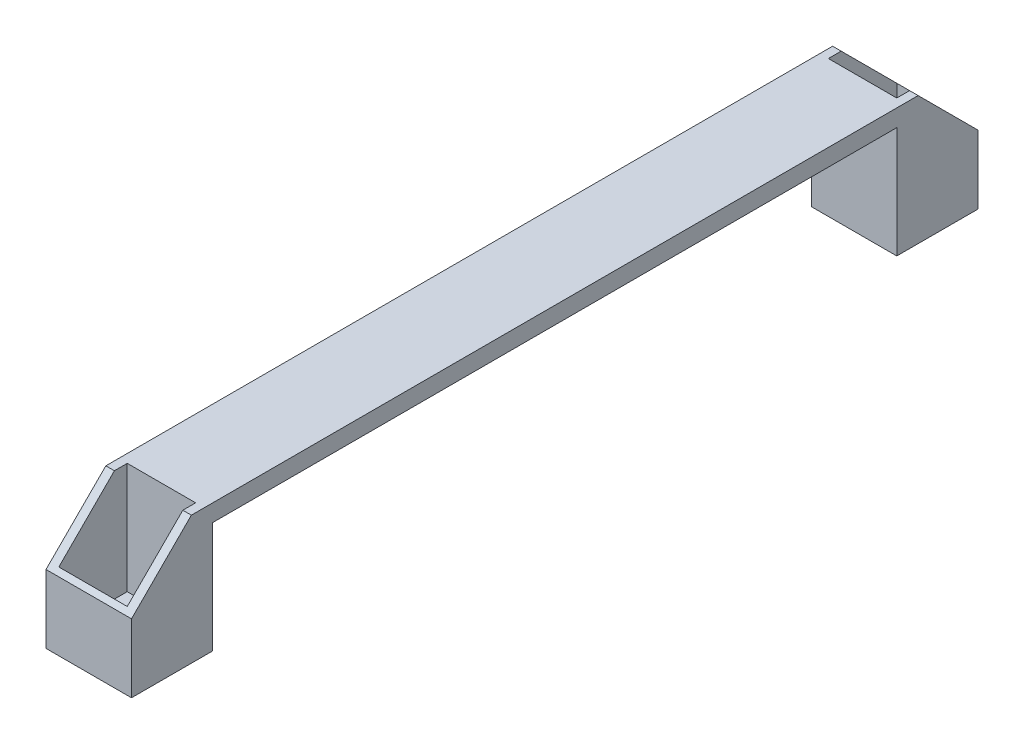
from build123d import *

# Parameters (mm, degrees)
SKETCH2_W             = 20
SKETCH2_H             = 20
BOSS_EXTRUDE1_DEPTH   = 30
BOSS_EXTRUDE1_2_DEPTH = 30
SKETCH3_W             = 16
SKETCH3_H             = 16
CUT_EXTRUDE1_DEPTH    = 26
SKETCH4_R             = 3
CUT_EXTRUDE2_DEPTH    = 56
SKETCH7_W             = 20
SKETCH7_H             = 4
BOSS_EXTRUDE2_DEPTH   = 160
CUT_EXTRUDE5_DEPTH    = 140
SKETCH10_W            = 1
SKETCH10_H            = 37.358544319
CUT_EXTRUDE6_DEPTH    = 140


with BuildPart() as part:
    # Sketch2 → Boss-Extrude1 (new body)
    with BuildSketch(Plane(origin=(0, 0, 0), x_dir=(1, 0, 0), z_dir=(0, 1, 0))):
        with Locations((10, 10)):
            Rectangle(SKETCH2_W, SKETCH2_H)
    extrude(amount=BOSS_EXTRUDE1_DEPTH)


with BuildPart() as body_2:
    # Sketch2 → Boss-Extrude1 2 (new body)
    with BuildSketch(Plane(origin=(0, 0, 0), x_dir=(1, 0, 0), z_dir=(0, 1, 0))):
        with Locations((10, -170)):
            Rectangle(SKETCH2_W, SKETCH2_H)
    extrude(amount=BOSS_EXTRUDE1_2_DEPTH)


with BuildPart() as cut_extrude1_tool:
    # Sketch3 → Cut-Extrude1 (new body)
    with BuildSketch(Plane(origin=(0, 30, 0), x_dir=(1, 0, 0), z_dir=(0, 1, 0))):
        with Locations((10, 10)):
            Rectangle(SKETCH3_W, SKETCH3_H)
        with Locations((10, -170)):
            Rectangle(SKETCH3_W, SKETCH3_H)
    extrude(amount=-CUT_EXTRUDE1_DEPTH)


with BuildPart() as part_1:
    add(part.part)

    # Cut-Extrude1: cut by cut_extrude1_tool
    add(cut_extrude1_tool.part, mode=Mode.SUBTRACT)


with BuildPart() as body_2_1:
    add(body_2.part)

    # Cut-Extrude1: cut by cut_extrude1_tool
    add(cut_extrude1_tool.part, mode=Mode.SUBTRACT)


with BuildPart() as cut_extrude2_tool:
    # Sketch4 → Cut-Extrude2 (new body)
    with BuildSketch(Plane(origin=(0, 4, 0), x_dir=(1, 0, 0), z_dir=(0, 1, 0))):
        with Locations(Location((10, -170, 0), (0, 0, 270))):
            Circle(SKETCH4_R)
        with Locations(Location((10, 10, 0), (0, 0, 270))):
            Circle(SKETCH4_R)
    extrude(amount=-CUT_EXTRUDE2_DEPTH)


with BuildPart() as part_2:
    add(part_1.part)

    # Cut-Extrude2: cut by cut_extrude2_tool
    add(cut_extrude2_tool.part, mode=Mode.SUBTRACT)



with BuildPart() as body_2_2:
    add(body_2_1.part)

    # Cut-Extrude2: cut by cut_extrude2_tool
    add(cut_extrude2_tool.part, mode=Mode.SUBTRACT)


with BuildPart() as part_3:
    add(part_2.part)

    add(body_2_2.part)  # Boss-Extrude2 merges body 2
    # Sketch7 → Boss-Extrude2 (add)
    with BuildSketch(Plane(origin=(0, 0, 160), x_dir=(-1, 0, 0), z_dir=(0, 0, -1))):
        with Locations((-10, 28)):
            Rectangle(SKETCH7_W, SKETCH7_H)
    extrude(amount=BOSS_EXTRUDE2_DEPTH)

    # Sketch9 → Cut-Extrude5 (cut)
    with BuildSketch(Plane(origin=(20, 0, 0), x_dir=(0, 0, -1), z_dir=(1, 0, 0))):
        Polygon((-180, 15), (-165, 30), (-180, 30), align=None)
        Polygon((20, 15), (5, 30), (20, 30), align=None)
    extrude(amount=-CUT_EXTRUDE5_DEPTH, mode=Mode.SUBTRACT)

    # Sketch10 → Cut-Extrude6 (cut)
    with BuildSketch(Plane(origin=(20, 0, 0), x_dir=(0, 0, -1), z_dir=(1, 0, 0))):
        with Locations((-179.5, 18.67927216)):
            Rectangle(SKETCH10_W, SKETCH10_H)
        with Locations((19.5, 18.67927216)):
            Rectangle(SKETCH10_W, SKETCH10_H)
    extrude(amount=-CUT_EXTRUDE6_DEPTH, mode=Mode.SUBTRACT)


solid = part_3.part
